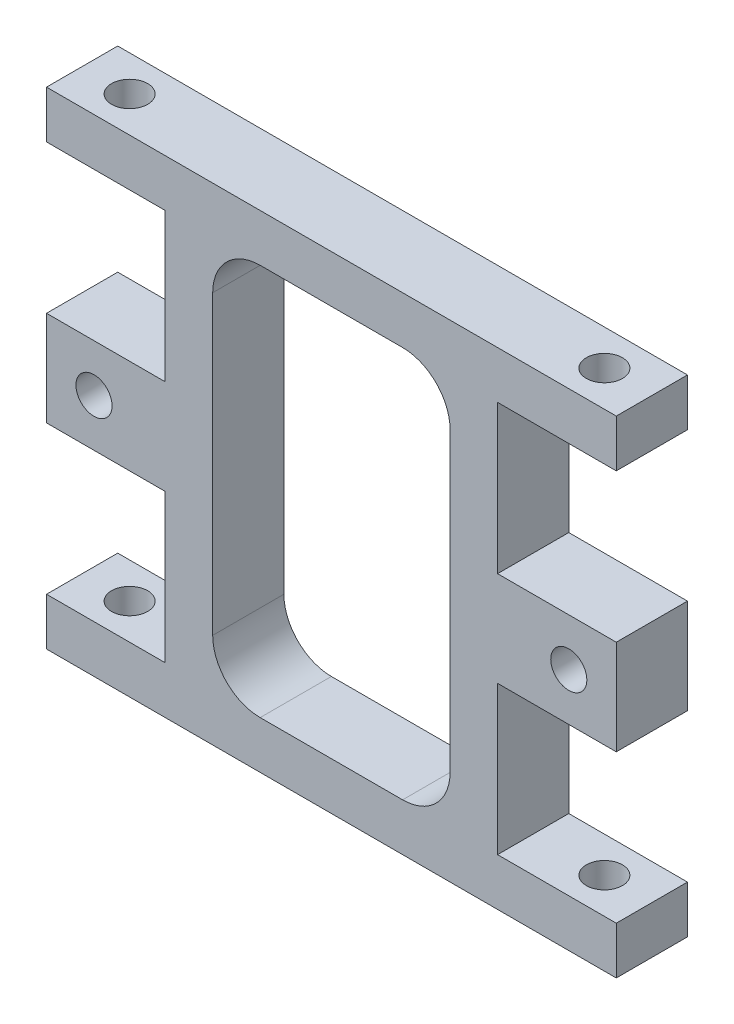
from build123d import *

# Parameters (mm, degrees)
SKETCH2_R           = 2.413
SKETCH2_W           = 31.75
SKETCH2_H           = 52.3875
BOSS_EXTRUDE1_DEPTH = 9.525
FILLET1_R           = 6.35
CUT_EXTRUDE1_REACH  = 78.018
SKETCH3_R           = 2.413
CUT_EXTRUDE2_REACH  = 78.018
SKETCH4_R           = 2.413


with BuildPart() as part:
    # Sketch2 → Boss-Extrude1 (new body)
    with BuildSketch(Plane.XY):
        Polygon((-22.225, -26.19375), (-22.225, -6.35), (-38.1, -6.35), (-38.1, 6.35), (-22.225, 6.35), (-22.225, 26.19375), (-38.1, 26.19375), (-38.1, 32.54375), (38.1, 32.54375), (38.1, 26.19375), (22.225, 26.19375), (22.225, 6.35), (38.1, 6.35), (38.1, -6.35), (22.225, -6.35), (22.225, -26.19375), (38.1, -26.19375), (38.1, -32.54375), (-38.1, -32.54375), (-38.1, -26.19375), align=None)
        with Locations(Location((-31.75, 0, 0), (0, 0, 180))):
            Circle(SKETCH2_R, mode=Mode.SUBTRACT)
        with Locations(Location((31.75, 0, 0), (0, 0, 180))):
            Circle(SKETCH2_R, mode=Mode.SUBTRACT)
        Rectangle(SKETCH2_W, SKETCH2_H, mode=Mode.SUBTRACT)
    extrude(amount=BOSS_EXTRUDE1_DEPTH)

    # Fillet1
    fillet1_edges = [part.edges().sort_by_distance(p)[0] for p in [
        (-15.875, 26.19375, 4.7625),
        (-15.875, -26.19375, 4.7625),
        (15.875, -26.19375, 4.7625),
        (15.875, 26.19375, 4.7625),
    ]]
    fillet(fillet1_edges, radius=FILLET1_R)

    # Sketch3 → Cut-Extrude1 (cut, up to next)
    with BuildSketch(Plane(origin=(0, 32.54375, 0), x_dir=(1, 0, 0), z_dir=(0, 1, 0)), mode=Mode.PRIVATE) as cut_extrude1_sk1:
        with Locations(Location((-31.75, -4.7625, 0), (0, 0, 270))):
            Circle(SKETCH3_R)
    cut_extrude1_tool1 = extrude(cut_extrude1_sk1.sketch, amount=-CUT_EXTRUDE1_REACH, mode=Mode.PRIVATE) & part.part
    # Sketch3 → Cut-Extrude1 (cut, up to next)
    with BuildSketch(Plane(origin=(0, 32.54375, 0), x_dir=(1, 0, 0), z_dir=(0, 1, 0)), mode=Mode.PRIVATE) as cut_extrude1_sk2:
        with Locations(Location((31.75, -4.7625, 0), (0, 0, 270))):
            Circle(SKETCH3_R)
    cut_extrude1_tool2 = extrude(cut_extrude1_sk2.sketch, amount=-CUT_EXTRUDE1_REACH, mode=Mode.PRIVATE) & part.part
    add(cut_extrude1_tool1.solids().sort_by_distance((-31.75, 32.54375, 4.7625))[0], mode=Mode.SUBTRACT)
    add(cut_extrude1_tool2.solids().sort_by_distance((31.75, 32.54375, 4.7625))[0], mode=Mode.SUBTRACT)

    # Sketch4 → Cut-Extrude2 (cut, up to next)
    with BuildSketch(Plane.XZ.offset(32.54375), mode=Mode.PRIVATE) as cut_extrude2_sk1:
        with Locations(Location((-31.75, 4.7625, 0), (0, 0, 90))):
            Circle(SKETCH4_R)
    cut_extrude2_tool1 = extrude(cut_extrude2_sk1.sketch, amount=-CUT_EXTRUDE2_REACH, mode=Mode.PRIVATE) & part.part
    # Sketch4 → Cut-Extrude2 (cut, up to next)
    with BuildSketch(Plane.XZ.offset(32.54375), mode=Mode.PRIVATE) as cut_extrude2_sk2:
        with Locations(Location((31.75, 4.7625, 0), (0, 0, 90))):
            Circle(SKETCH4_R)
    cut_extrude2_tool2 = extrude(cut_extrude2_sk2.sketch, amount=-CUT_EXTRUDE2_REACH, mode=Mode.PRIVATE) & part.part
    add(cut_extrude2_tool1.solids().sort_by_distance((-31.75, -32.54375, 4.7625))[0], mode=Mode.SUBTRACT)
    add(cut_extrude2_tool2.solids().sort_by_distance((31.75, -32.54375, 4.7625))[0], mode=Mode.SUBTRACT)


solid = part.part
